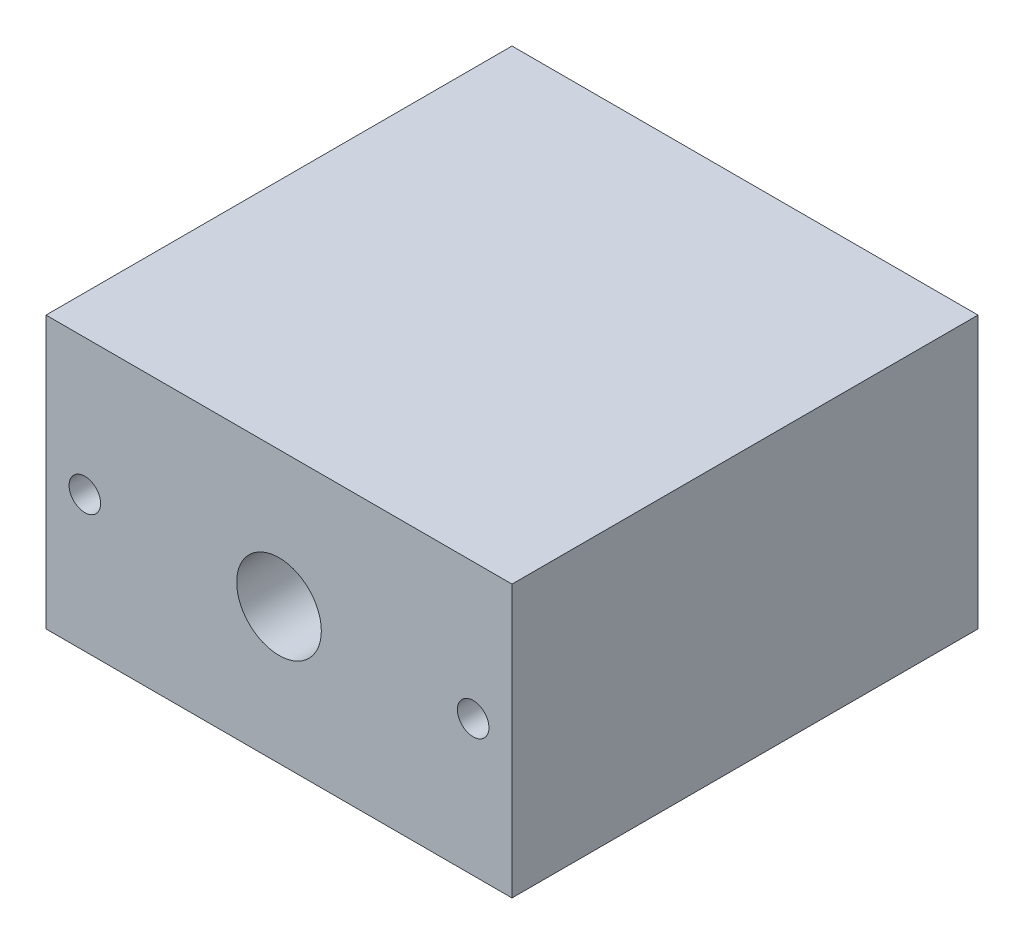
from build123d import *

# Parameters (mm, degrees)
SKETCH1_W           = 152.4
SKETCH1_H           = 88.9
BOSS_EXTRUDE1_DEPTH = 152.4
SKETCH2_R           = 13.843
CUT_EXTRUDE1_DEPTH  = 234.141008834
SKETCH3_R           = 5.1562
CUT_EXTRUDE2_DEPTH  = 234.141008834


with BuildPart() as part:
    # Sketch1 → Boss-Extrude1 (new body)
    with BuildSketch(Plane.XY):
        with Locations((76.2, 44.45)):
            Rectangle(SKETCH1_W, SKETCH1_H)
    extrude(amount=BOSS_EXTRUDE1_DEPTH)

    # Sketch2 → Cut-Extrude1 (cut, through all)
    with BuildSketch(Plane.XY):
        with Locations((76.2, 44.45)):
            Circle(SKETCH2_R)
    extrude(amount=CUT_EXTRUDE1_DEPTH, mode=Mode.SUBTRACT)

    # Sketch3 → Cut-Extrude2 (cut, through all)
    with BuildSketch(Plane.XY):
        with Locations((12.7, 44.45)):
            Circle(SKETCH3_R)
        with Locations((139.7, 44.45)):
            Circle(SKETCH3_R)
    extrude(amount=CUT_EXTRUDE2_DEPTH, mode=Mode.SUBTRACT)


solid = part.part
